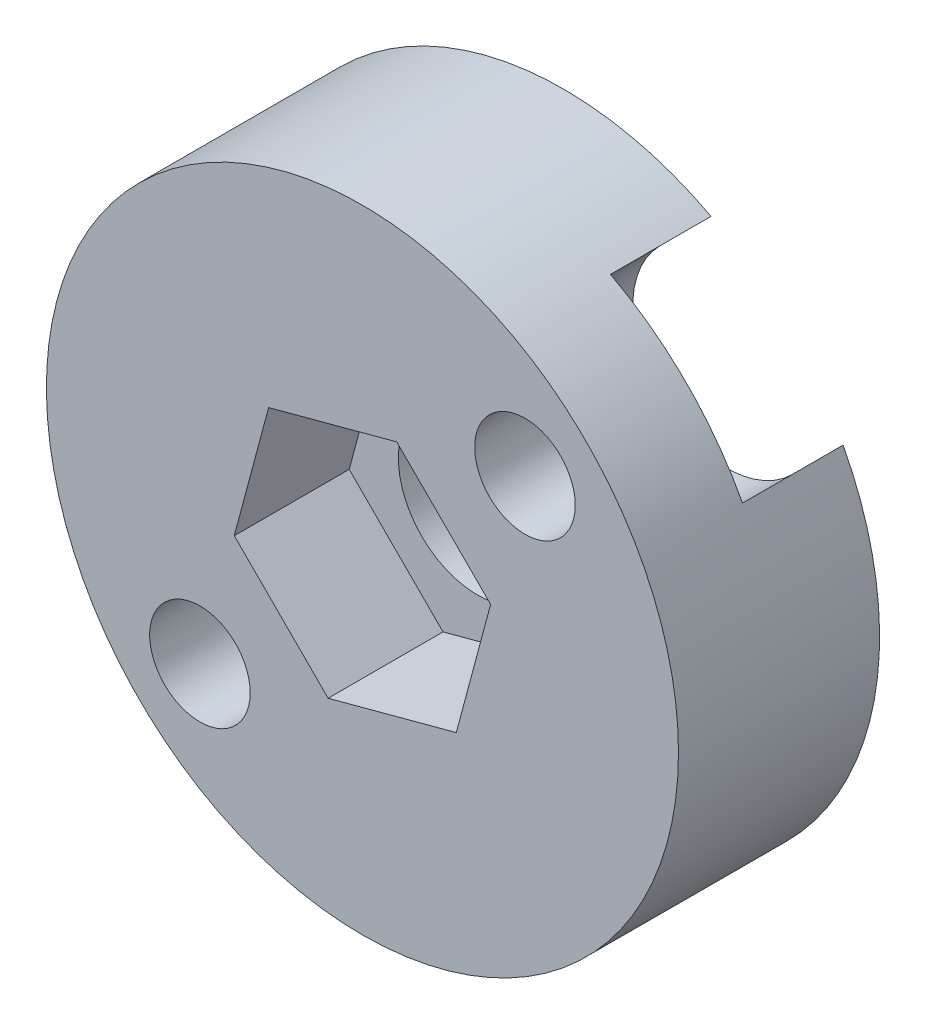
from build123d import *

# Parameters (mm, degrees)
ESBO_O1_R                = 11
ESBO_O1_R_2              = 1.75
ESBO_O1_R_3              = 2.75
RESSALTO_EXTRUS_O1_DEPTH = 7
CORTE_EXTRUS_O5_DEPTH    = 4
ESBO_O12_R               = 1.75
CORTE_EXTRUS_O6_DEPTH    = 3.5
PADR_OCIRCULAR1_COUNT    = 2


with BuildPart() as part:
    # Esboço1 → Ressalto-extrusão1 (new body)
    with BuildSketch(Plane.XY):
        Circle(ESBO_O1_R)
        with Locations((5.656854249, 5.656854249)):
            Circle(ESBO_O1_R_2, mode=Mode.SUBTRACT)
        with Locations((-5.656854249, -5.656854249)):
            Circle(ESBO_O1_R_2, mode=Mode.SUBTRACT)
        Circle(ESBO_O1_R_3, mode=Mode.SUBTRACT)
    extrude(amount=RESSALTO_EXTRUS_O1_DEPTH)

    # Esboço10 → Corte-extrusão5 (cut)
    with BuildSketch(Plane.XY.offset(7)):
        Polygon((-1.195433963, -4.461420287), (3.265986324, -3.265986324), (4.461420287, 1.195433963), (1.195433963, 4.461420287), (-3.265986324, 3.265986324), (-4.461420287, -1.195433963), align=None)
    extrude(amount=-CORTE_EXTRUS_O5_DEPTH, mode=Mode.SUBTRACT)

    # Esboço12 → Corte-extrusão6 (cut)
    with BuildSketch(Plane(origin=(0, 0, 0), x_dir=(-1, 0, 0), z_dir=(0, 0, -1))):
        with BuildLine():
            ThreePointArc((-7.954951288, 3.358757211), (-3.358757211, 3.358757211), (-3.358757211, 7.954951288))
            Line((-3.358757211, 7.954951288), (-5.132834935, 9.729029013))
            ThreePointArc((-5.132834935, 9.729029013), (-7.778174593, 7.778174593), (-9.729029013, 5.132834935))
            Line((-9.729029013, 5.132834935), (-7.954951288, 3.358757211))
        make_face()
        with Locations(Location((-5.656854249, 5.656854249, 0), (0, 0, 180))):
            Circle(ESBO_O12_R, mode=Mode.SUBTRACT)
    corte_extrus_o6 = extrude(amount=-CORTE_EXTRUS_O6_DEPTH, mode=Mode.SUBTRACT)

    # PadrãoCircular1: Corte-extrusão6 ×2 about axis
    padr_ocircular1_axis = Axis((0, 0, 0), (0, 0, 1))
    for i in range(1, PADR_OCIRCULAR1_COUNT):
        add(corte_extrus_o6.rotate(padr_ocircular1_axis, i * 360 / PADR_OCIRCULAR1_COUNT), mode=Mode.SUBTRACT)


solid = part.part
